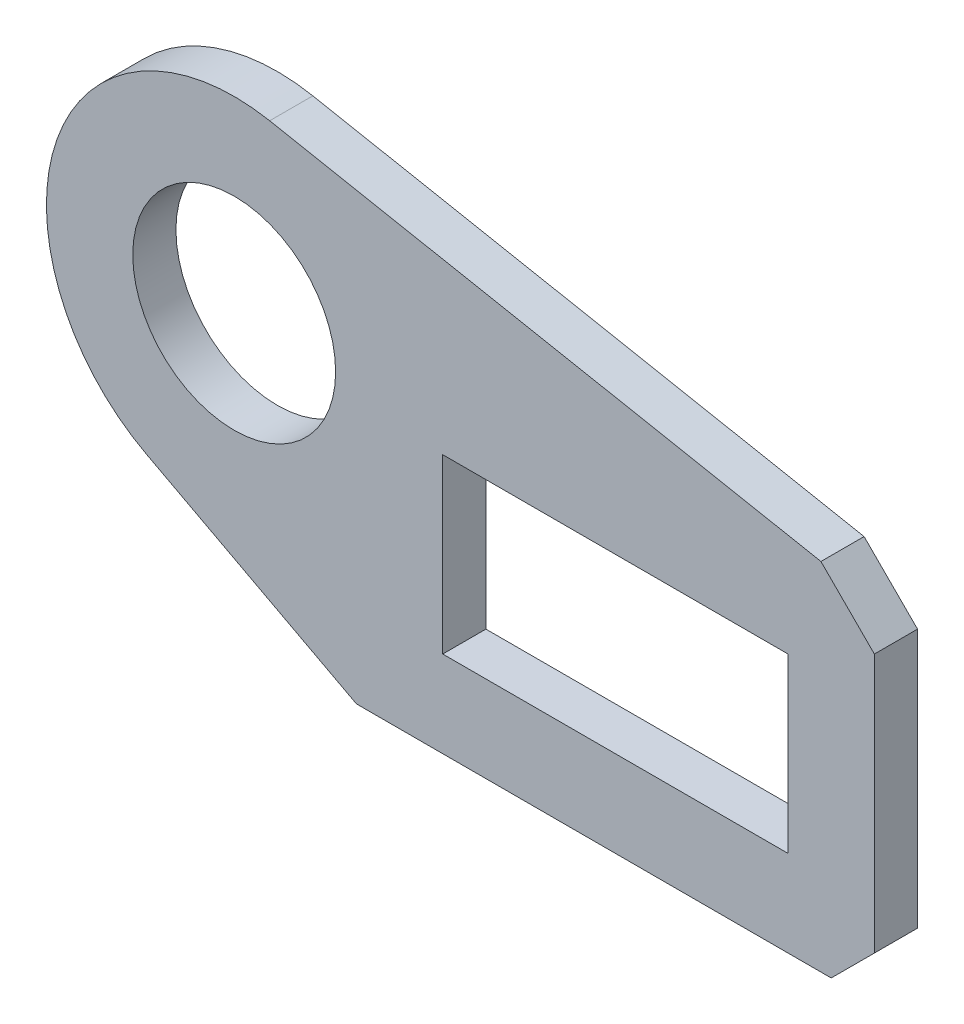
from build123d import *
from OCP.BRepFilletAPI import BRepFilletAPI_MakeChamfer

# Parameters (mm, degrees)
ESQUISSE1_R        = 23.5
ESQUISSE1_W        = 80
ESQUISSE1_H        = 40
BOSS_EXTRU_1_DEPTH = 10
CHANFREIN1_SIZE    = 10
CHANFREIN1_SIZE2   = 12.608056975


with BuildPart() as part:
    # Esquisse1 → Boss.-Extru.1 (new body)
    with BuildSketch(Plane.XY):
        with BuildLine():
            Line((0, 0), (120, 0))
            Line((120, 0), (120, 80))
            Line((120, 80), (-20.100018314, 106.944225709))
            ThreePointArc((-20.100018314, 106.944225709), (-69.345781346, 78.675628662), (-48.678780146, 25.787692258))
            Line((-48.678780146, 25.787692258), (0, 0))
        make_face()
        with Locations((-28.315442857, 64.227053523)):
            Circle(ESQUISSE1_R, mode=Mode.SUBTRACT)
        with Locations((60, 40)):
            Rectangle(ESQUISSE1_W, ESQUISSE1_H, mode=Mode.SUBTRACT)
    extrude(amount=BOSS_EXTRU_1_DEPTH)

    # Chanfrein1: one chamfer whose edges measure the first distance from different faces: ONE call of the kernel's chamfer builder (chamfer() names one face for all edges)
    chanfrein1_edges_1 = [part.edges().sort_by_distance(p)[0] for p in [
        (120, 80, 5),
    ]]
    chanfrein1_side_1 = [part.faces().sort_by_distance(p)[0] for p in [
        (120, 40, 5),
    ]]
    chanfrein1_edges_2 = [part.edges().sort_by_distance(p)[0] for p in [
        (120, 0, 5),
    ]]
    chanfrein1 = BRepFilletAPI_MakeChamfer(part.part.solid().wrapped)
    for e in chanfrein1_edges_1:
        chanfrein1.Add(CHANFREIN1_SIZE, CHANFREIN1_SIZE2, e.wrapped, chanfrein1_side_1[0].wrapped)  # the first distance lies on this face
    for e in chanfrein1_edges_2:
        chanfrein1.Add(CHANFREIN1_SIZE, e.wrapped)
    add(Compound.cast(chanfrein1.Shape()), mode=Mode.REPLACE)


solid = part.part
